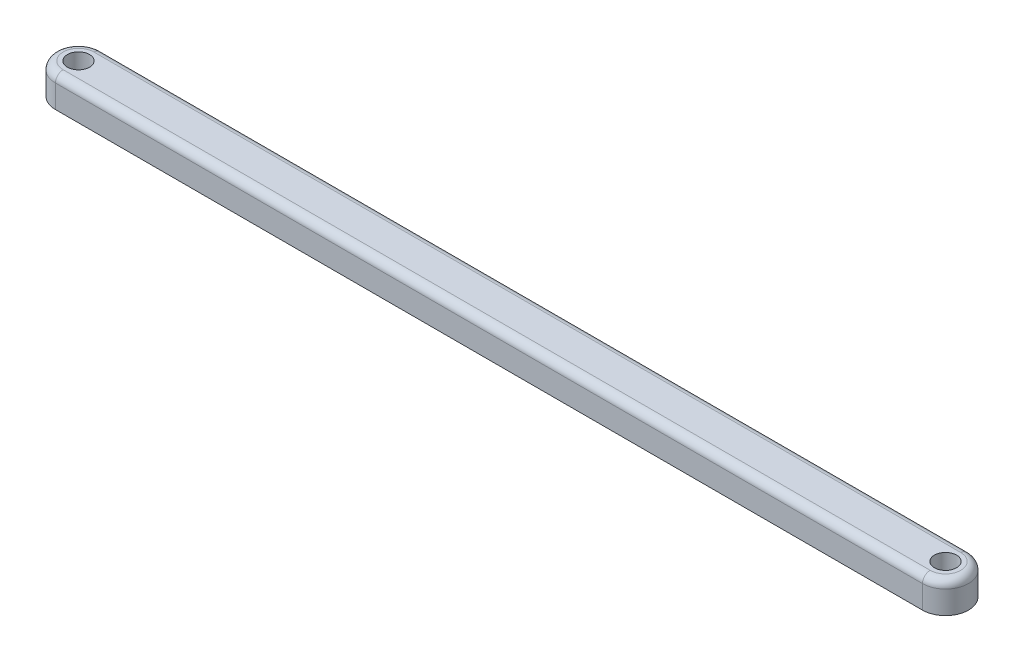
from build123d import *

# Parameters (mm, degrees)
BOSS_EXTRUDE1_DEPTH = 3.175
SKETCH2_R           = 2.286
CUT_EXTRUDE1_DEPTH  = 185.320987428
FILLET1_R           = 1.5875


with BuildPart() as part:
    # Sketch1 → Boss-Extrude1 (new, symmetric)
    with BuildSketch(Plane(origin=(0, 0, 0), x_dir=(1, 0, 0), z_dir=(0, 1, 0))):
        with BuildLine():
            Line((0, 4.7625), (179.3875, 4.7625))
            ThreePointArc((179.3875, 4.7625), (184.15, 0), (179.3875, -4.7625))
            Line((179.3875, -4.7625), (0, -4.7625))
            ThreePointArc((0, -4.7625), (-4.7625, 0), (0, 4.7625))
        make_face()
    extrude(amount=BOSS_EXTRUDE1_DEPTH, both=True)

    # Sketch2 → Cut-Extrude1 (cut, through all)
    with BuildSketch(Plane(origin=(0, 3.175, 0), x_dir=(1, 0, 0), z_dir=(0, 1, 0))):
        with Locations(Location((0, 0, 0), (0, 0, 270))):
            Circle(SKETCH2_R)
        with Locations(Location((179.3875, 0, 0), (0, 0, 270))):
            Circle(SKETCH2_R)
    extrude(amount=-CUT_EXTRUDE1_DEPTH, mode=Mode.SUBTRACT)

    # Fillet1
    fillet1_edges = [part.edges().sort_by_distance(p)[0] for p in [
        (184.15, 3.175, 0),
        (89.69375, 3.175, -4.7625),
        (-4.7625, 3.175, 0),
        (89.69375, 3.175, 4.7625),
    ]]
    fillet(fillet1_edges, radius=FILLET1_R)


solid = part.part
